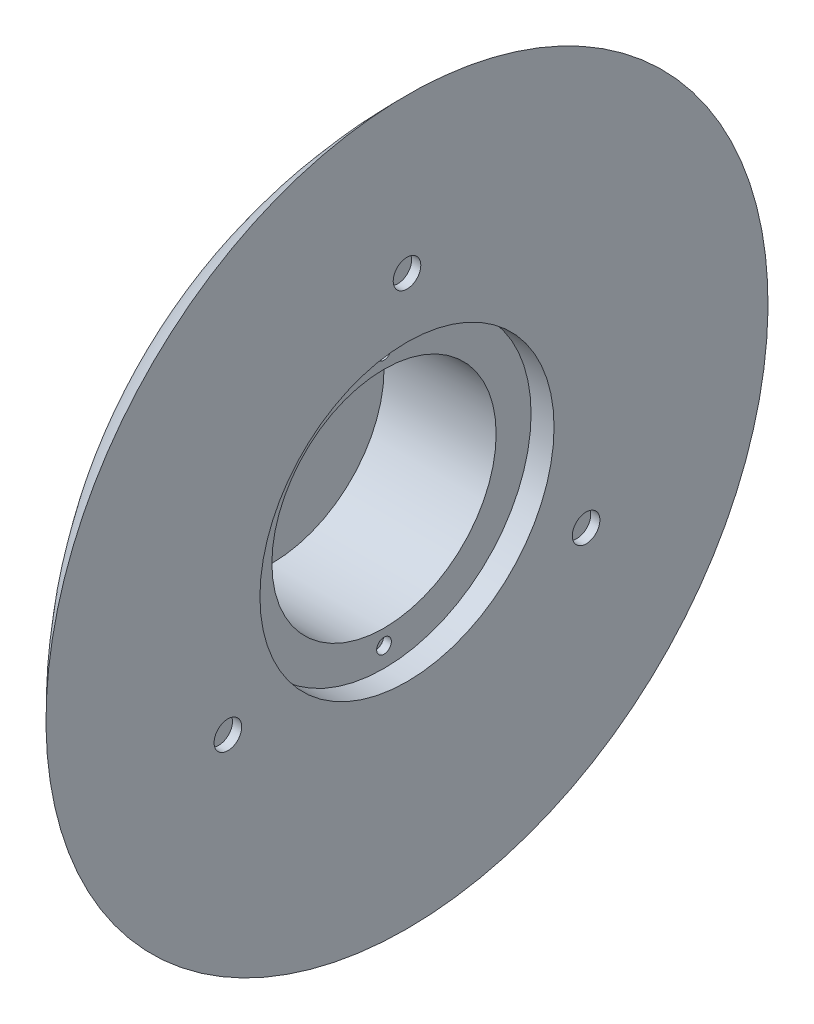
from build123d import *
from build123d.topology import SkipClean

# Parameters (mm, degrees)
CUT_EXTRUDE_1_DEPTH      = 96.262794416
CUT_EXTRUDE_1_DEPTH_BACK = 96.262794416
SKETCH_3_R               = 12.2
CUT_EXTRUDE_2_DEPTH      = 14.7
SKETCH_4_R               = 3
CUT_EXTRUDE_3_DEPTH      = 0.7
SKETCH_5_R               = 1.5
EXTRUDE_1_DEPTH          = 1
CUT_EXTRUDE_START        = -2
SKETCH_6_R               = 1.5
CUT_EXTRUDE_4_DEPTH      = 2
SKETCH_7_R               = 16
CUT_EXTRUDE_5_DEPTH      = 2.5
SKETCH_8_R               = 1.598234635
CUT_EXTRUDE_6_DEPTH      = 1.33
SKETCH_9_R               = 0.8
CUT_EXTRUDE_9_DEPTH      = 1.98
EXTRUDE_START            = 1.98
SKETCH_13_R              = 0.8
EXTRUDE_2_DEPTH          = 1.98
EXTRUDE_START_2          = 1.33
SKETCH_15_R              = 1.598234635
EXTRUDE_3_DEPTH          = 1.33
SKETCH_18_R              = 0.8
EXTRUDE_5_DEPTH          = 1.98
SKETCH_16_R              = 1.598234635
EXTRUDE_6_DEPTH          = 1.33
SKETCH_19_R              = 0.4
CUT_EXTRUDE_10_DEPTH     = 1.98
CUT_EXTRUDE_START_2      = 1.98
SKETCH_21_R              = 0.4
CUT_EXTRUDE_13_DEPTH     = 1.98
SKETCH_22_R              = 0.8
CUT_EXTRUDE_14_DEPTH     = 1.33
EXTRUDE_START_3          = 0.47
SKETCH_24_R              = 0.4
EXTRUDE_8_DEPTH          = 0.47
SKETCH_25_R              = 0.8
SKETCH_25_R_2            = 0.4
EXTRUDE_10_DEPTH         = 0.47


with BuildPart() as part:
    # 草图1 → 旋转4 (revolve)
    with BuildSketch(Plane.XY):
        with BuildLine():
            Line((0, 55), (0, -55))
            ThreePointArc((0, -55), (-55, 0), (0, 55))
        make_face()
    revolve(axis=Axis((0, 55, 0), (0, -1, 0)))

    # 草图2 → 切除-拉伸1 (cut, two sides: drawn at the far end of the back side and taken through both)
    with SkipClean():  # the faces are left unmerged after this step: merging them gives an invalid solid
        with BuildSketch(Plane.XY.offset(-CUT_EXTRUDE_1_DEPTH_BACK)):
            Polygon((0, 55), (-38.5, 55), (-38.5, -53.32864138), (-38.5, -63.890241206), (57.744437859, -63.890241206), (57.744437859, 55), align=None)
        extrude(amount=CUT_EXTRUDE_1_DEPTH + CUT_EXTRUDE_1_DEPTH_BACK, mode=Mode.SUBTRACT)

    # 草图3 → 切除-拉伸2 (cut)
    with SkipClean():  # the faces are left unmerged after this step: merging them gives an invalid solid
        with BuildSketch(Plane(origin=(-38.5, 0, 0), x_dir=(0, 0, -1), z_dir=(1, 0, 0))):
            with Locations(Location((0, 0, 0), (0, 0, 90))):
                Circle(SKETCH_3_R)
        extrude(amount=-CUT_EXTRUDE_2_DEPTH, mode=Mode.SUBTRACT)

    # 草图4 → 切除-拉伸3 (cut)
    with SkipClean():  # the faces are left unmerged after this step: merging them gives an invalid solid
        with BuildSketch(Plane(origin=(-53.2, 0, 0), x_dir=(0, 0, -1), z_dir=(1, 0, 0))):
            with Locations(Location((0, 0, 0), (0, 0, 90))):
                Circle(SKETCH_4_R)
        extrude(amount=-CUT_EXTRUDE_3_DEPTH, mode=Mode.SUBTRACT)

    # 草图5 → 凸台-拉伸1 (add)
    with SkipClean():  # the faces are left unmerged after this step: merging them gives an invalid solid
        with BuildSketch(Plane(origin=(-38.5, 0, 0), x_dir=(0, 0, -1), z_dir=(1, 0, 0))):
            with Locations(Location((0, 22.5, 0), (0, 0, 270))):
                Circle(SKETCH_5_R)
            with Locations(Location((19.485571585, -11.25, 0), (0, 0, 270))):
                Circle(SKETCH_5_R)
            with Locations(Location((-19.485571585, -11.25, 0), (0, 0, 270))):
                Circle(SKETCH_5_R)
        extrude(amount=EXTRUDE_1_DEPTH)

    # 草图6 → 切除-拉伸4 (cut)
    with SkipClean():  # the faces are left unmerged after this step: merging them gives an invalid solid
        with BuildSketch(Plane(origin=(-37.5, 0, 0), x_dir=(0, 0, -1), z_dir=(1, 0, 0)).offset(CUT_EXTRUDE_START)):
            with Locations(Location((0, 22.5, 0), (0, 0, 90))):
                Circle(SKETCH_6_R)
            with Locations(Location((-19.485571585, -11.25, 0), (0, 0, 90))):
                Circle(SKETCH_6_R)
            with Locations(Location((19.485571585, -11.25, 0), (0, 0, 90))):
                Circle(SKETCH_6_R)
        extrude(amount=CUT_EXTRUDE_4_DEPTH, mode=Mode.SUBTRACT)

    # 草图7 → 切除-拉伸5 (cut)
    with SkipClean():  # the faces are left unmerged after this step: merging them gives an invalid solid
        with BuildSketch(Plane(origin=(-38.5, 0, 0), x_dir=(0, 0, -1), z_dir=(1, 0, 0))):
            with Locations(Location((0, 0, 0), (0, 0, 90))):
                Circle(SKETCH_7_R)
        extrude(amount=-CUT_EXTRUDE_5_DEPTH, mode=Mode.SUBTRACT)

    # 草图8 → 切除-拉伸6 (cut)
    with SkipClean():  # the faces are left unmerged after this step: merging them gives an invalid solid
        with BuildSketch(Plane(origin=(-41, 0, 0), x_dir=(0, 0, -1), z_dir=(1, 0, 0))):
            with Locations(Location((0, 14.008048354, 0), (0, 0, 90))):
                Circle(SKETCH_8_R)
            with Locations(Location((0, -14.008048354, 0), (0, 0, 270))):
                Circle(SKETCH_8_R)
        extrude(amount=-CUT_EXTRUDE_6_DEPTH, mode=Mode.SUBTRACT)

    # 草图9 → 切除-拉伸9 (cut)
    with SkipClean():  # the faces are left unmerged after this step: merging them gives an invalid solid
        with BuildSketch(Plane(origin=(-41, 0, 0), x_dir=(0, 0, -1), z_dir=(1, 0, 0))):
            with Locations(Location((0, 14.008048354, 0), (0, 0, 90))):
                Circle(SKETCH_9_R)
            with Locations(Location((0, -14.008048354, 0), (0, 0, 270))):
                Circle(SKETCH_9_R)
        extrude(amount=-CUT_EXTRUDE_9_DEPTH, mode=Mode.SUBTRACT)

    # 草图13 → 凸台-拉伸2 (add)
    with SkipClean():  # the faces are left unmerged after this step: merging them gives an invalid solid
        with BuildSketch(Plane(origin=(-42.98, 0, 0), x_dir=(0, 0, -1), z_dir=(1, 0, 0)).offset(EXTRUDE_START)):
            with Locations(Location((0, 14.008048354, 0), (0, 0, 90))):
                Circle(SKETCH_13_R)
        extrude(amount=-EXTRUDE_2_DEPTH)

    # 草图15 → 凸台-拉伸3 (add)
    with SkipClean():  # the faces are left unmerged after this step: merging them gives an invalid solid
        with BuildSketch(Plane(origin=(-42.33, 0, 0), x_dir=(0, 0, -1), z_dir=(1, 0, 0)).offset(EXTRUDE_START_2)):
            with Locations((0, 14.008048354)):
                Circle(SKETCH_15_R)
        extrude(amount=-EXTRUDE_3_DEPTH)

    # 草图18 → 凸台-拉伸5 (add)
    with SkipClean():  # the faces are left unmerged after this step: merging them gives an invalid solid
        with BuildSketch(Plane(origin=(-42.98, 0, 0), x_dir=(0, 0, -1), z_dir=(1, 0, 0)).offset(EXTRUDE_START)):
            with Locations(Location((0, -14.008048354, 0), (0, 0, 270))):
                Circle(SKETCH_18_R)
        extrude(amount=-EXTRUDE_5_DEPTH)

    # 草图16 → 凸台-拉伸6 (add)
    with SkipClean():  # the faces are left unmerged after this step: merging them gives an invalid solid
        with BuildSketch(Plane(origin=(-42.33, 0, 0), x_dir=(0, 0, -1), z_dir=(1, 0, 0)).offset(EXTRUDE_START_2)):
            with Locations((0, -14.008048354)):
                Circle(SKETCH_16_R)
        extrude(amount=-EXTRUDE_6_DEPTH)

    # 草图19 → 切除-拉伸10 (cut)
    with SkipClean():  # the faces are left unmerged after this step: merging them gives an invalid solid
        with BuildSketch(Plane(origin=(-41, 0, 0), x_dir=(0, 0, -1), z_dir=(1, 0, 0))):
            with Locations(Location((0, 13.850429171, 0), (0, 0, 90))):
                Circle(SKETCH_19_R)
        extrude(amount=-CUT_EXTRUDE_10_DEPTH, mode=Mode.SUBTRACT)

    # 草图21 → 切除-拉伸13 (cut)
    with SkipClean():  # the faces are left unmerged after this step: merging them gives an invalid solid
        with BuildSketch(Plane(origin=(-42.98, 0, 0), x_dir=(0, 0, -1), z_dir=(1, 0, 0)).offset(CUT_EXTRUDE_START_2)):
            with Locations(Location((0, 13.850429171, 0), (0, 0, 90))):
                Circle(SKETCH_21_R)
            with Locations(Location((0, -13.850429171, 0), (0, 0, 270))):
                Circle(SKETCH_21_R)
        extrude(amount=-CUT_EXTRUDE_13_DEPTH, mode=Mode.SUBTRACT)

    # 草图22 → 切除-拉伸14 (cut)
    with SkipClean():  # the faces are left unmerged after this step: merging them gives an invalid solid
        with BuildSketch(Plane(origin=(-41, 0, 0), x_dir=(0, 0, -1), z_dir=(1, 0, 0))):
            with Locations(Location((0, 13.850429171, 0), (0, 0, 90))):
                Circle(SKETCH_22_R)
            with Locations(Location((0, -13.850429171, 0), (0, 0, 270))):
                Circle(SKETCH_22_R)
        extrude(amount=-CUT_EXTRUDE_14_DEPTH, mode=Mode.SUBTRACT)

    # 草图24 → 凸台-拉伸8 (add)
    with SkipClean():  # the faces are left unmerged after this step: merging them gives an invalid solid
        with BuildSketch(Plane(origin=(-42.98, 0, 0), x_dir=(0, 0, -1), z_dir=(1, 0, 0)).offset(EXTRUDE_START_3)):
            with Locations(Location((0, 13.850429171, 0), (0, 0, 90))):
                Circle(SKETCH_24_R)
            with Locations(Location((0, -13.850429171, 0), (0, 0, 270))):
                Circle(SKETCH_24_R)
        extrude(amount=-EXTRUDE_8_DEPTH)

    # 草图25 → 凸台-拉伸10 (add)
    # profile 1 of 2: a face of its own
    with SkipClean():  # the faces are left unmerged after this step: merging them gives an invalid solid
        with BuildSketch(Plane(origin=(-42.33, 0, 0), x_dir=(0, 0, -1), z_dir=(1, 0, 0)).offset(EXTRUDE_START_3)):
            with Locations(Location((0, 13.850429171, 0), (0, 0, 90))):
                Circle(SKETCH_25_R)
            with Locations(Location((0, 13.850429171, 0), (0, 0, 90))):
                Circle(SKETCH_25_R_2, mode=Mode.SUBTRACT)
        # profile 2 of 2: a face of its own
        with BuildSketch(Plane(origin=(-42.33, 0, 0), x_dir=(0, 0, -1), z_dir=(1, 0, 0)).offset(EXTRUDE_START_3)):
            with Locations(Location((0, -13.850429171, 0), (0, 0, 90))):
                Circle(SKETCH_25_R)
            with Locations(Location((0, -13.850429171, 0), (0, 0, 90))):
                Circle(SKETCH_25_R_2, mode=Mode.SUBTRACT)
        extrude(amount=-EXTRUDE_10_DEPTH)


solid = part.part
